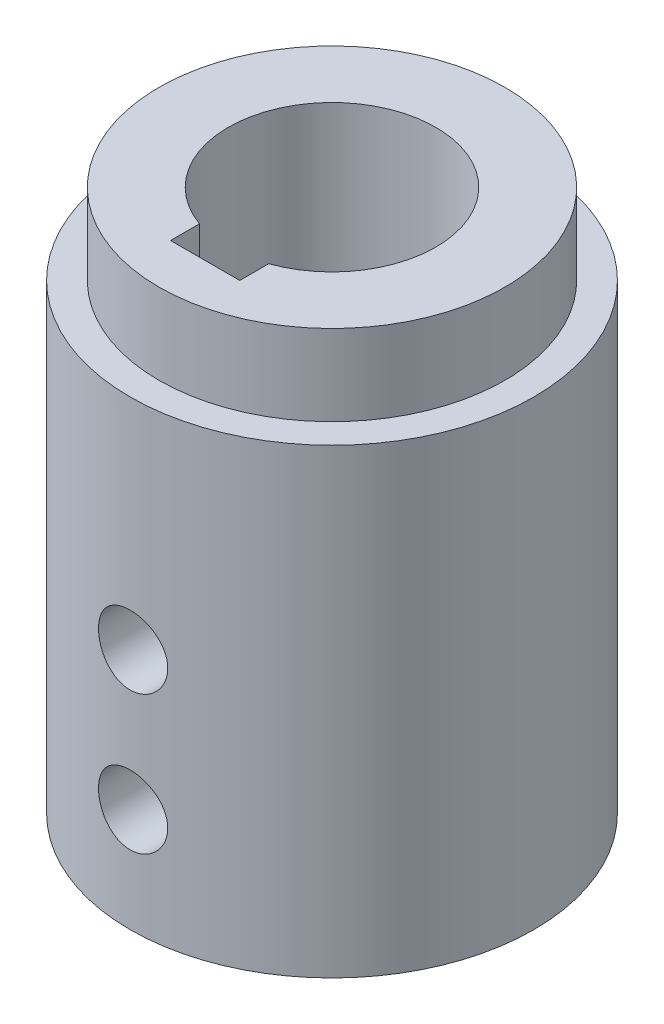
from build123d import *

# Parameters (mm, degrees)
SKETCH1_R               = 17.5
BOSS_EXTRUDE1_DEPTH     = 47
CUT_EXTRUDE1_START      = -7
SKETCH2_R               = 17.5
SKETCH2_R_2             = 15
CUT_EXTRUDE1_DEPTH      = 7
CUT_EXTRUDE2_DEPTH      = 54.117793629
CUT_EXTRUDE3_REACH      = 59.684
CUT_EXTRUDE3_END_RADIUS = 17.5
SKETCH4_R               = 3


with BuildPart() as part:
    # Sketch1 → Boss-Extrude1 (new body)
    with BuildSketch(Plane(origin=(0, 0, 0), x_dir=(1, 0, 0), z_dir=(0, 1, 0))):
        with Locations(Location((0, 0, 0), (0, 0, 270))):
            Circle(SKETCH1_R)
    extrude(amount=BOSS_EXTRUDE1_DEPTH)

    # Sketch2 → Cut-Extrude1 (cut)
    with BuildSketch(Plane(origin=(0, 47, 0), x_dir=(1, 0, 0), z_dir=(0, 1, 0)).offset(CUT_EXTRUDE1_START)):
        with Locations(Location((0, 0, 0), (0, 0, 270))):
            Circle(SKETCH2_R)
        with Locations(Location((0, 0, 0), (0, 0, 270))):
            Circle(SKETCH2_R_2, mode=Mode.SUBTRACT)
    extrude(amount=CUT_EXTRUDE1_DEPTH, mode=Mode.SUBTRACT)

    # Sketch3 → Cut-Extrude2 (cut, through all)
    with BuildSketch(Plane.XZ):
        with BuildLine():
            Line((0, 11), (-3, 11))
            Line((-3, 11), (-3, 8.485281374))
            ThreePointArc((-3, 8.485281374), (0, -9), (3, 8.485281374))
            Line((3, 8.485281374), (3, 11))
            Line((3, 11), (0, 11))
        make_face()
    extrude(amount=-CUT_EXTRUDE2_DEPTH, mode=Mode.SUBTRACT)

    # Cut-Extrude3: up to this cylinder (the profile starts inside it)
    cut_extrude3_end = Plane(origin=(0, 15, 0), z_dir=(0, -1, 0)) * Cylinder(CUT_EXTRUDE3_END_RADIUS, 167.368, mode=Mode.PRIVATE)
    # Sketch4 → Cut-Extrude3 (cut, up to the surface)
    with BuildSketch(Plane(origin=(0, 0, 11), x_dir=(-1, 0, 0), z_dir=(0, 0, -1)), mode=Mode.PRIVATE) as cut_extrude3_sk1:
        with Locations((0, 9)):
            Circle(SKETCH4_R)
    cut_extrude3_tool1 = extrude(cut_extrude3_sk1.sketch, amount=-CUT_EXTRUDE3_REACH, mode=Mode.PRIVATE) & cut_extrude3_end
    add(cut_extrude3_tool1.solids().sort_by_distance((0, 9, 11))[0], mode=Mode.SUBTRACT)
    # Sketch4 → Cut-Extrude3 (cut, up to the surface)
    with BuildSketch(Plane(origin=(0, 0, 11), x_dir=(-1, 0, 0), z_dir=(0, 0, -1)), mode=Mode.PRIVATE) as cut_extrude3_sk2:
        with Locations((0, 21)):
            Circle(SKETCH4_R)
    cut_extrude3_tool2 = extrude(cut_extrude3_sk2.sketch, amount=-CUT_EXTRUDE3_REACH, mode=Mode.PRIVATE) & cut_extrude3_end
    add(cut_extrude3_tool2.solids().sort_by_distance((0, 21, 11))[0], mode=Mode.SUBTRACT)


solid = part.part
